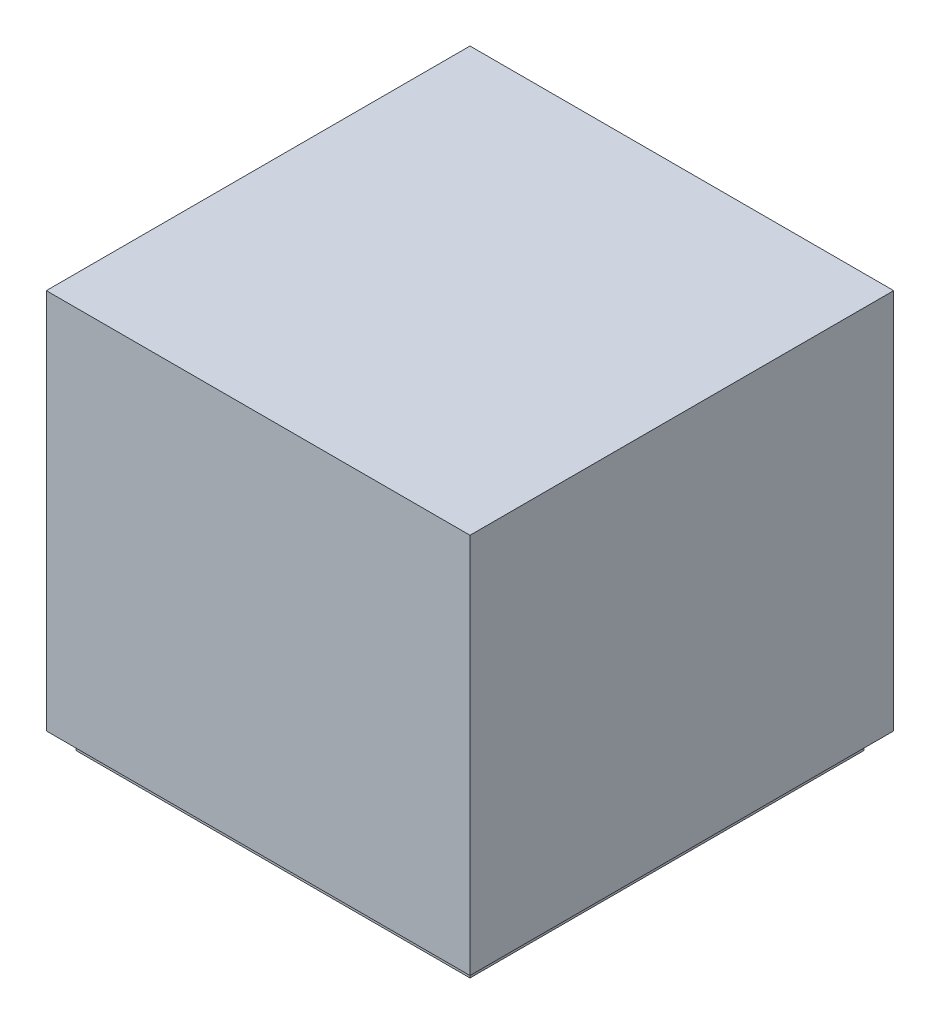
from build123d import *

# Parameters (mm, degrees)
SKETCH1_W           = 1000
SKETCH1_H           = 1000
SKETCH1_W_2         = 930
SKETCH1_H_2         = 930
SKETCH1_W_3         = 850
SKETCH1_H_3         = 850
BOSS_EXTRUDE2_DEPTH = 900
SKETCH1_4_W         = 930
SKETCH1_4_H         = 930
SKETCH1_4_W_2       = 850
SKETCH1_4_H_2       = 850
BOSS_EXTRUDE3_DEPTH = 40
BOSS_EXTRUDE4_START = 900
SKETCH1_5_W         = 850
SKETCH1_5_H         = 850
BOSS_EXTRUDE4_DEPTH = 2


with BuildPart() as part:
    # Sketch1 → Boss-Extrude2 (new body)
    # profile 1 of 2: a face of its own
    with BuildSketch(Plane(origin=(0, 0, 0), x_dir=(1, 0, 0), z_dir=(0, 1, 0))):
        Rectangle(SKETCH1_W, SKETCH1_H)
        Rectangle(SKETCH1_W_2, SKETCH1_H_2, mode=Mode.SUBTRACT)
    # profile 2 of 2: a face of its own
    with BuildSketch(Plane(origin=(0, 0, 0), x_dir=(1, 0, 0), z_dir=(0, 1, 0))):
        Rectangle(SKETCH1_W_2, SKETCH1_H_2)
        Rectangle(SKETCH1_W_3, SKETCH1_H_3, mode=Mode.SUBTRACT)
    extrude(amount=BOSS_EXTRUDE2_DEPTH)

    # Sketch1<4> → Boss-Extrude3 (add)
    with BuildSketch(Plane(origin=(0, 0, 0), x_dir=(1, 0, 0), z_dir=(0, 1, 0))):
        Rectangle(SKETCH1_4_W, SKETCH1_4_H)
        Rectangle(SKETCH1_4_W_2, SKETCH1_4_H_2, mode=Mode.SUBTRACT)
    extrude(amount=-BOSS_EXTRUDE3_DEPTH)

    # Sketch1<5> → Boss-Extrude4 (add)
    with BuildSketch(Plane(origin=(0, 0, 0), x_dir=(1, 0, 0), z_dir=(0, 1, 0)).offset(BOSS_EXTRUDE4_START)):
        Rectangle(SKETCH1_5_W, SKETCH1_5_H)
    extrude(amount=-BOSS_EXTRUDE4_DEPTH)


solid = part.part
